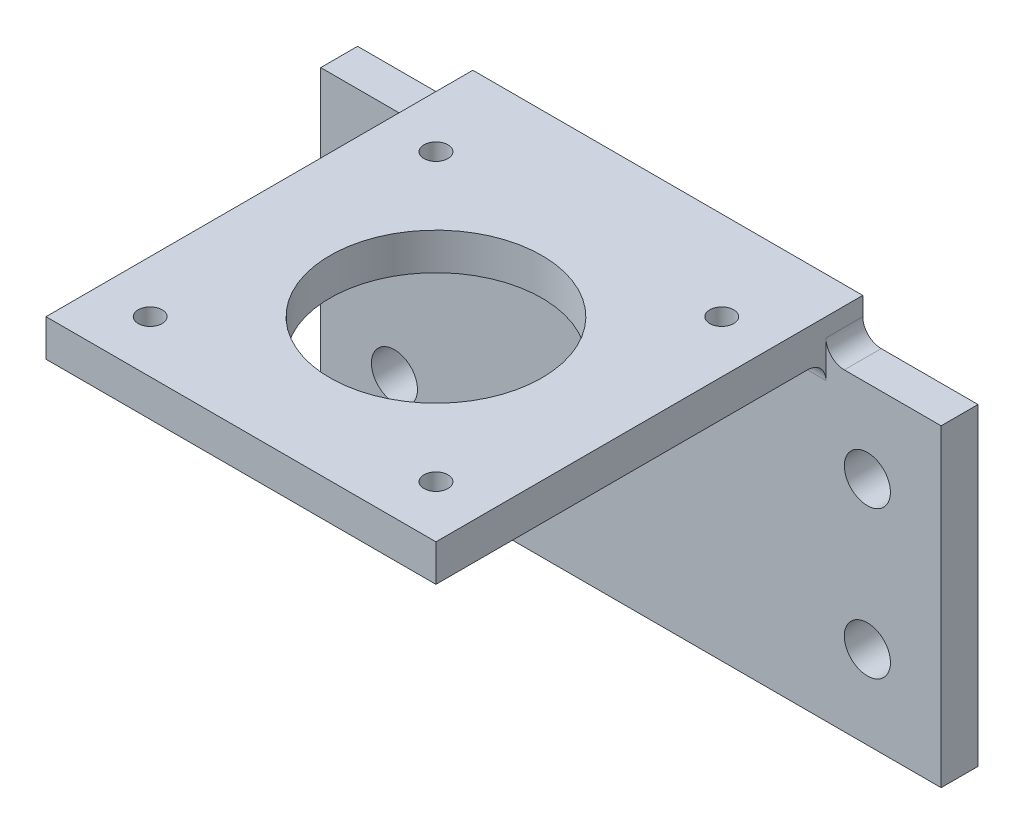
from build123d import *

# Parameters (mm, degrees)
SKETCH_1_W          = 67.3
SKETCH_1_H          = 34
EXTRUDE_1_DEPTH     = 4
SKETCH_2_W          = 21.15
SKETCH_2_H          = 4
EXTRUDE_2_DEPTH     = 42.3
SKETCH_3_W          = 42.3
SKETCH_3_H          = 4
EXTRUDE_3_DEPTH     = 4
FILLET_1_R          = 2
FILLET_2_R          = 2
SKETCH_4_R          = 1.3
SKETCH_4_R_2        = 11.5
CUT_EXTRUDE_1_DEPTH = 4
SKETCH_5_R          = 2.5
CUT_EXTRUDE_2_DEPTH = 4


with BuildPart() as part:
    # 草图1 → 凸台-拉伸1 (new body)
    with BuildSketch(Plane.XY):
        Rectangle(SKETCH_1_W, SKETCH_1_H)
    extrude(amount=EXTRUDE_1_DEPTH)



with BuildPart() as body_2:
    # 草图2 → 凸台-拉伸2 (new body)
    with BuildSketch(Plane.XY.offset(4)):
        with Locations((-10.575, 19)):
            Rectangle(SKETCH_2_W, SKETCH_2_H)
        with Locations((10.575, 19)):
            Rectangle(SKETCH_2_W, SKETCH_2_H)
    extrude(amount=EXTRUDE_2_DEPTH)


with BuildPart() as part_1:
    add(part.part)

    add(body_2.part)  # 凸台-拉伸3 merges body 2
    # 草图3 → 凸台-拉伸3 (add)
    with BuildSketch(Plane(origin=(0, 0, 4), x_dir=(-1, 0, 0), z_dir=(0, 0, -1))):
        with Locations((0, 19)):
            Rectangle(SKETCH_3_W, SKETCH_3_H)
    extrude(amount=EXTRUDE_3_DEPTH)

    # 圆角1
    fillet_1_edges = [part_1.edges().sort_by_distance(p)[0] for p in [
        (0, 17, 4),
    ]]
    fillet(fillet_1_edges, radius=FILLET_1_R)

    # 圆角2
    fillet_2_edges = [part_1.edges().sort_by_distance(p)[0] for p in [
        (-21.15, 17, 2),
        (21.15, 17, 2),
    ]]
    fillet(fillet_2_edges, radius=FILLET_2_R)

    # 草图4 → 切除-拉伸1 (cut)
    with BuildSketch(Plane.XZ.offset(-17)):
        with Locations((-15.5, 40.65)):
            Circle(SKETCH_4_R)
        with Locations((15.5, 40.65)):
            Circle(SKETCH_4_R)
        with Locations((-15.5, 9.65)):
            Circle(SKETCH_4_R)
        with Locations((15.5, 9.65)):
            Circle(SKETCH_4_R)
        with Locations((0, 25.15)):
            Circle(SKETCH_4_R_2)
    extrude(amount=-CUT_EXTRUDE_1_DEPTH, mode=Mode.SUBTRACT)

    # 草图5 → 切除-拉伸2 (cut)
    with BuildSketch(Plane.XY.offset(4)):
        with Locations((-25.65, 8)):
            Circle(SKETCH_5_R)
        with Locations(Location((-25.65, -8, 0), (0, 0, 180))):
            Circle(SKETCH_5_R)
        with Locations(Location((25.65, 8, 0), (0, 0, 180))):
            Circle(SKETCH_5_R)
        with Locations((25.65, -8)):
            Circle(SKETCH_5_R)
    extrude(amount=-CUT_EXTRUDE_2_DEPTH, mode=Mode.SUBTRACT)


solid = part_1.part
